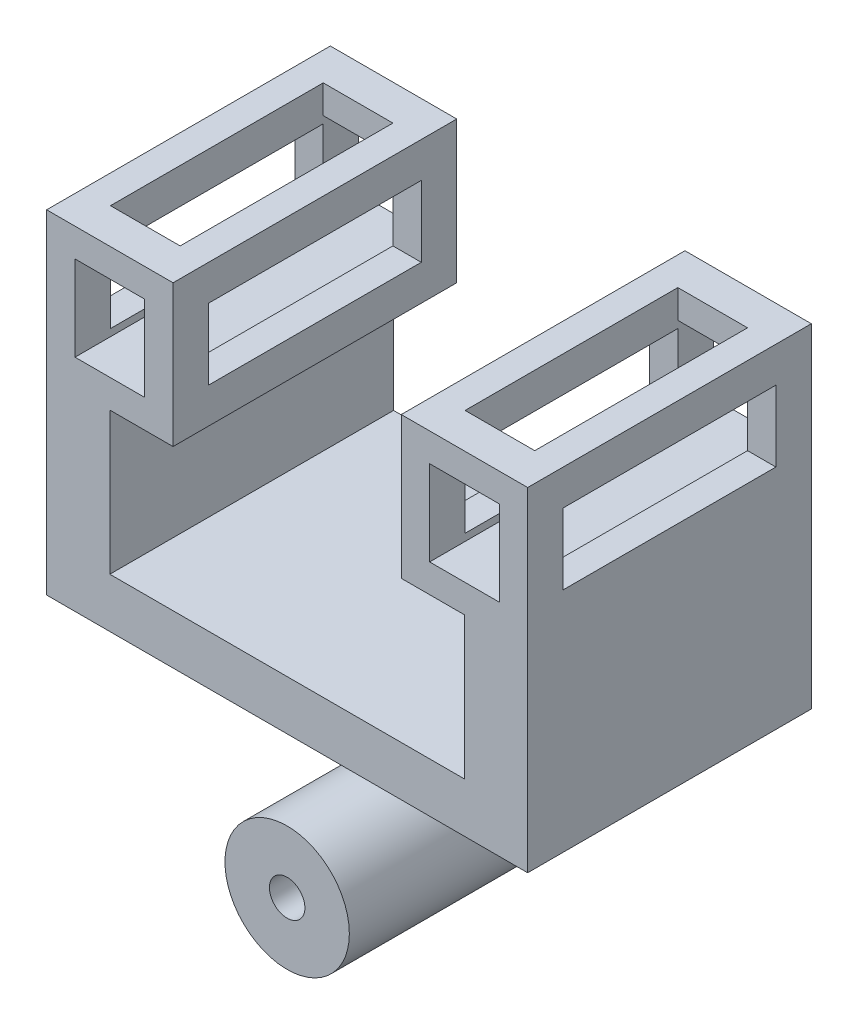
from build123d import *

# Parameters (mm, degrees)
BOSS_EXTRUDE1_DEPTH            = 2.521826736
SKETCH2_R                      = 11.136118556
BOSS_EXTRUDE2_DEPTH            = 50.8
SKETCH3_W                      = 86.137031446
SKETCH3_H                      = 59.748072355
BOSS_EXTRUDE3_DEPTH            = 50.8
CUT_EXTRUDE1_DEPTH             = 109.100560925
CUT_EXTRUDE2_REACH             = 110.101
SKETCH6_R                      = 3.175
CUT_EXTRUDE3_DEPTH             = 118.741599385
CUT_EXTRUDE3_DEPTH_BACK        = 118.741599385
SKETCH8_W                      = 38.1
SKETCH8_H                      = 12.7
CUT_EXTRUDE4_REACH             = 119.073
SKETCH9_W                      = 12.477031446
SKETCH9_H                      = 38.1
CUT_EXTRUDE4_DIRECTION_2_DEPTH = 118.073406314
SKETCH10_W                     = 12.477031446
SKETCH10_H                     = 15.24
CUT_EXTRUDE5_DEPTH             = 109.100560925


with BuildPart() as part:
    # Sketch1 → Boss-Extrude1 (new body)
    with BuildSketch(Plane.XY):
        with BuildLine():
            Line((-11.136118556, 0), (-11.136118556, 25.4))
            Line((-11.136118556, 25.4), (11.136118556, 25.4))
            Line((11.136118556, 25.4), (11.136118556, 0))
            ThreePointArc((11.136118556, 0), (0, 11.136118556), (-11.136118556, 0))
        make_face()
    boss_extrude1 = extrude(amount=BOSS_EXTRUDE1_DEPTH)

    # Sketch2 → Boss-Extrude2 (add)
    with BuildSketch(Plane.XY):
        Circle(SKETCH2_R)
    extrude(amount=BOSS_EXTRUDE2_DEPTH)

    # Sketch3 → Boss-Extrude3 (add)
    with BuildSketch(Plane.XY):
        with Locations((0, 55.274036178)):
            Rectangle(SKETCH3_W, SKETCH3_H)
    extrude(amount=BOSS_EXTRUDE3_DEPTH)

    # Sketch4 → Cut-Extrude1 (cut, through all)
    with BuildSketch(Plane.XY.offset(50.8)):
        Polygon((20.431484277, 85.148072355), (20.431484277, 59.748072355), (31.75, 59.748072355), (31.75, 34.29), (-31.75, 34.29), (-31.75, 59.748072355), (-20.431484277, 59.748072355), (-20.431484277, 85.148072355), align=None)
    extrude(amount=-CUT_EXTRUDE1_DEPTH, mode=Mode.SUBTRACT)

    # Mirror1: Boss-Extrude1 across plane
    add(boss_extrude1.mirror(Plane(origin=(0, 0, 12.7), x_dir=(1, 0, 0), z_dir=(0, 0, -1))))

    # Sketch6 → Cut-Extrude2 (cut, up to next)
    with BuildSketch(Plane.XY.offset(50.8), mode=Mode.PRIVATE) as cut_extrude2_sk1:
        Circle(SKETCH6_R)
    cut_extrude2_tool1 = extrude(cut_extrude2_sk1.sketch, amount=-CUT_EXTRUDE2_REACH, mode=Mode.PRIVATE) & part.part
    add(cut_extrude2_tool1.solids().sort_by_distance((0, 0, 50.8))[0], mode=Mode.SUBTRACT)

    # Sketch8 → Cut-Extrude3 (cut, two sides: drawn at the far end of the back side and taken through both)
    with BuildSketch(Plane(origin=(-20.431484277, 0, 0), x_dir=(0, 0, -1), z_dir=(1, 0, 0)).offset(-CUT_EXTRUDE3_DEPTH_BACK)):
        with Locations((-25.4, 72.448072355)):
            Rectangle(SKETCH8_W, SKETCH8_H)
    extrude(amount=CUT_EXTRUDE3_DEPTH + CUT_EXTRUDE3_DEPTH_BACK, mode=Mode.SUBTRACT)

    # Sketch9 → Cut-Extrude4 (cut, up to next)
    with BuildSketch(Plane(origin=(0, 85.148072355, 0), x_dir=(1, 0, 0), z_dir=(0, 1, 0)), mode=Mode.PRIVATE) as cut_extrude4_sk1:
        with Locations((-31.75, -25.4)):
            Rectangle(SKETCH9_W, SKETCH9_H)
    cut_extrude4_tool1 = extrude(cut_extrude4_sk1.sketch, amount=-CUT_EXTRUDE4_REACH, mode=Mode.PRIVATE) & part.part
    # Sketch9 → Cut-Extrude4 (cut, up to next)
    with BuildSketch(Plane(origin=(0, 85.148072355, 0), x_dir=(1, 0, 0), z_dir=(0, 1, 0)), mode=Mode.PRIVATE) as cut_extrude4_sk2:
        with Locations((31.75, -25.4)):
            Rectangle(SKETCH9_W, SKETCH9_H)
    cut_extrude4_tool2 = extrude(cut_extrude4_sk2.sketch, amount=-CUT_EXTRUDE4_REACH, mode=Mode.PRIVATE) & part.part
    add(cut_extrude4_tool1.solids().sort_by_distance((-31.75, 85.148072, 25.4))[0], mode=Mode.SUBTRACT)
    add(cut_extrude4_tool2.solids().sort_by_distance((31.75, 85.148072, 25.4))[0], mode=Mode.SUBTRACT)

    # Sketch9 → Cut-Extrude4 direction 2 (cut)
    with BuildSketch(Plane(origin=(0, 85.148072355, 0), x_dir=(1, 0, 0), z_dir=(0, 1, 0))):
        with Locations((-31.75, -25.4)):
            Rectangle(SKETCH9_W, SKETCH9_H)
        with Locations((31.75, -25.4)):
            Rectangle(SKETCH9_W, SKETCH9_H)
    extrude(amount=CUT_EXTRUDE4_DIRECTION_2_DEPTH, mode=Mode.SUBTRACT)

    # Sketch10 → Cut-Extrude5 (cut, through all)
    with BuildSketch(Plane.XY.offset(50.8)):
        with Locations((-31.75, 72.448072355)):
            Rectangle(SKETCH10_W, SKETCH10_H)
        with Locations((31.75, 72.448072355)):
            Rectangle(SKETCH10_W, SKETCH10_H)
    extrude(amount=-CUT_EXTRUDE5_DEPTH, mode=Mode.SUBTRACT)


solid = part.part
